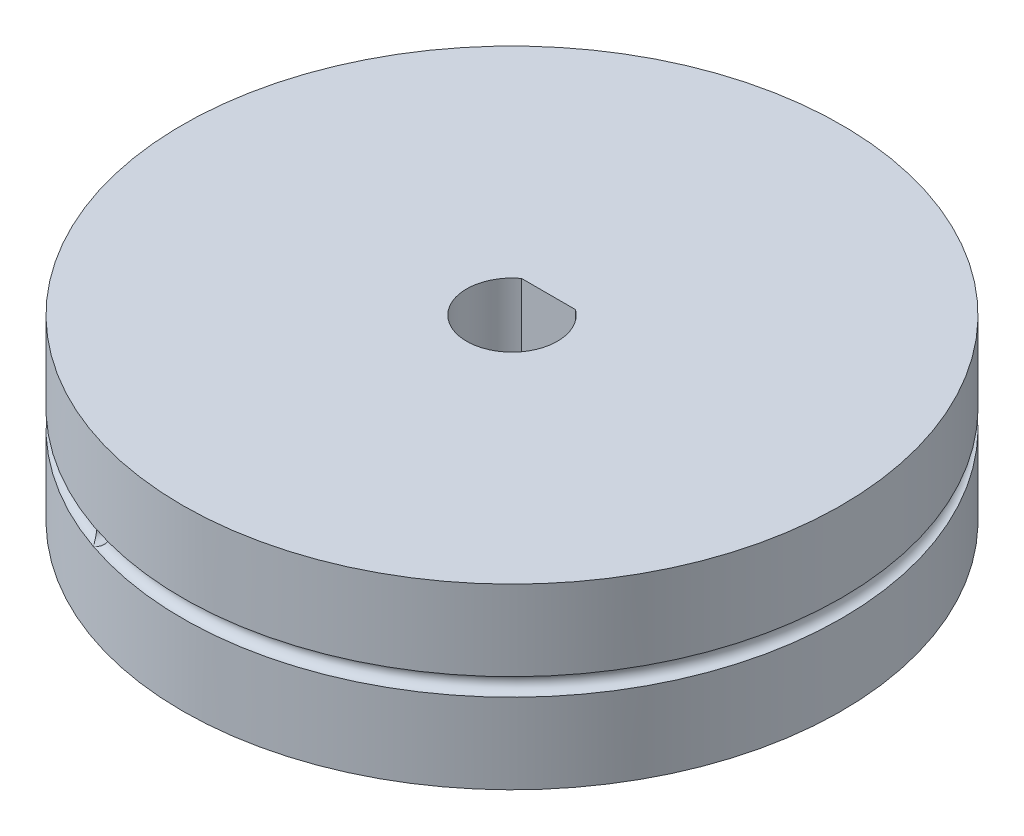
from build123d import *

# Parameters (mm, degrees)
SKETCH1_R                                 = 18.5
BOSS_EXTRUDE1_DEPTH                       = 10
SKETCH2_R                                 = 0.5
CUT_EXTRUDE1_REACH                        = 30.009
CUT_EXTRUDE2_REACH                        = 30.009
CUT_EXTRUDE2_END_MAJOR_RADIUS             = 18.5
CUT_EXTRUDE2_END_MINOR_RADIUS             = 0.5
SKETCH4_R                                 = 0.5
CUT_EXTRUDE2_DIRECTION_2_REACH            = 30.009
CUT_EXTRUDE2_DIRECTION_2_END_MAJOR_RADIUS = 18.5
CUT_EXTRUDE2_DIRECTION_2_END_MINOR_RADIUS = 0.5


with BuildPart() as part:
    # Sketch1 → Boss-Extrude1 (new body)
    with BuildSketch(Plane(origin=(0, 0, 0), x_dir=(1, 0, 0), z_dir=(0, 1, 0))):
        with Locations(Location((0, 0, 0), (0, 0, 270))):
            Circle(SKETCH1_R)
    extrude(amount=BOSS_EXTRUDE1_DEPTH)

    # Sketch2 → Cut-Revolve1 (revolve, cut)
    with BuildSketch(Plane.XY, mode=Mode.PRIVATE) as cut_revolve1_sk:
        with Locations((-18.5, 5)):
            Circle(SKETCH2_R)
    revolve(cut_revolve1_sk.sketch.rotate(Axis((0, 22.422972825, 0), (0, -1, 0)), 270), axis=Axis((0, 22.422972825, 0), (0, -1, 0)), mode=Mode.SUBTRACT)

    # Sketch3 → Cut-Extrude1 (cut, up to next)
    with BuildSketch(Plane(origin=(0, 10, 0), x_dir=(1, 0, 0), z_dir=(0, 1, 0)), mode=Mode.PRIVATE) as cut_extrude1_sk1:
        with BuildLine():
            Line((1.516575089, 2.05), (-1.516575089, 2.05))
            ThreePointArc((-1.516575089, 2.05), (-1.147874889, -2.277033868), (2.55, 0))
            ThreePointArc((2.55, 0), (2.277033868, 1.147874889), (1.516575089, 2.05))
        make_face()
    cut_extrude1_tool1 = extrude(cut_extrude1_sk1.sketch, amount=-CUT_EXTRUDE1_REACH, mode=Mode.PRIVATE) & part.part
    add(cut_extrude1_tool1.solids().sort_by_distance((0, 10, 0.119895))[0], mode=Mode.SUBTRACT)

    # Cut-Extrude2: up to this torus (the profile starts outside it)
    cut_extrude2_end = Plane(origin=(0, 5, 0), z_dir=(0, 1, 0)) * Torus(CUT_EXTRUDE2_END_MAJOR_RADIUS, CUT_EXTRUDE2_END_MINOR_RADIUS, mode=Mode.PRIVATE)
    # Sketch4 → Cut-Extrude2 (cut, up to the surface)
    with BuildSketch(Plane.XY, mode=Mode.PRIVATE) as cut_extrude2_sk1:
        with Locations(Location((-6, 5, 0), (0, 0, 90))):
            Circle(SKETCH4_R)
    cut_extrude2_tool1 = extrude(cut_extrude2_sk1.sketch, amount=-CUT_EXTRUDE2_REACH, mode=Mode.PRIVATE) - cut_extrude2_end
    add(cut_extrude2_tool1.solids().sort_by_distance((-6, 5, 0))[0], mode=Mode.SUBTRACT)

    # Cut-Extrude2 direction 2: up to this torus (the profile starts outside it)
    cut_extrude2_direction_2_end = Plane(origin=(0, 5, 0), z_dir=(0, 1, 0)) * Torus(CUT_EXTRUDE2_DIRECTION_2_END_MAJOR_RADIUS, CUT_EXTRUDE2_DIRECTION_2_END_MINOR_RADIUS, mode=Mode.PRIVATE)
    # Sketch4 → Cut-Extrude2 direction 2 (cut, up to the surface)
    with BuildSketch(Plane.XY, mode=Mode.PRIVATE) as cut_extrude2_direction_2_sk1:
        with Locations(Location((-6, 5, 0), (0, 0, 90))):
            Circle(SKETCH4_R)
    cut_extrude2_direction_2_tool1 = extrude(cut_extrude2_direction_2_sk1.sketch, amount=CUT_EXTRUDE2_DIRECTION_2_REACH, mode=Mode.PRIVATE) - cut_extrude2_direction_2_end
    add(cut_extrude2_direction_2_tool1.solids().sort_by_distance((-6, 5, 0))[0], mode=Mode.SUBTRACT)


solid = part.part
